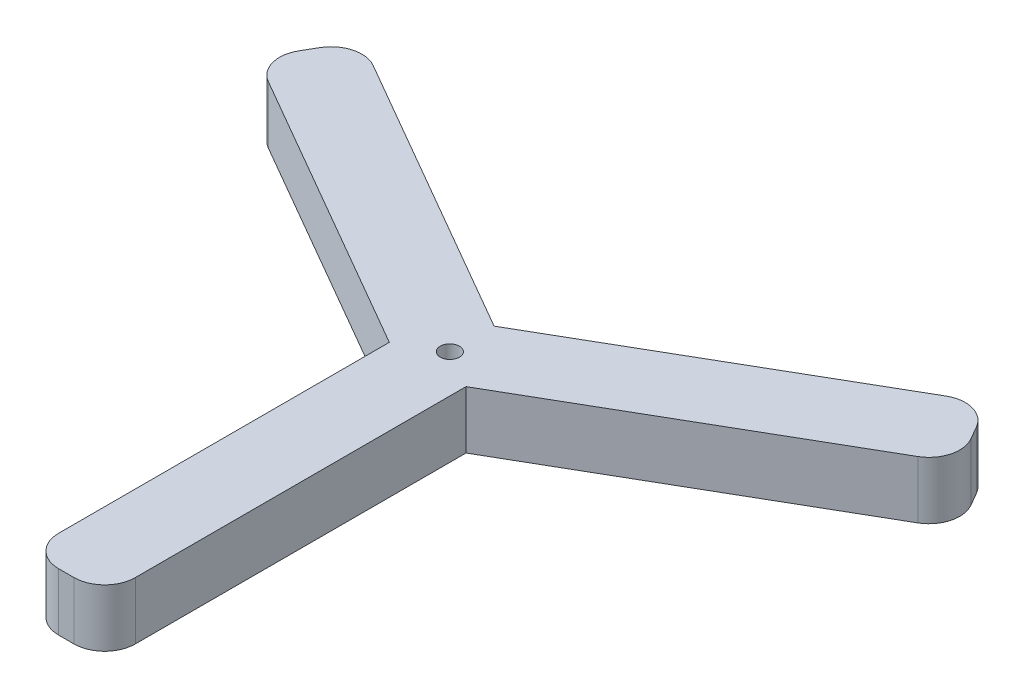
from build123d import *

# Parameters (mm, degrees)
BOSS_EXTRU_1_DEPTH      = 15
CONG_1_R                = 8
ESQUISSE2_R             = 2.5
ENL_V_MAT_EXTRU_1_DEPTH = 15


with BuildPart() as part:
    # Esquisse1 → Boss.-Extru.1 (new body)
    with BuildSketch(Plane(origin=(0, 0, 0), x_dir=(1, 0, 0), z_dir=(0, 1, 0))):
        with BuildLine():
            Line((84.674337148, 54.660254038), (10, 11.547005384))
            Line((10, 11.547005384), (-64.674337148, 54.660254038))
            ThreePointArc((-64.674337148, 54.660254038), (-70.744889509, 55.459457418), (-75.602540378, 51.732050808))
            Line((-75.602540378, 51.732050808), (-77.602540378, 48.267949192))
            ThreePointArc((-77.602540378, 48.267949192), (-78.401743758, 42.197396832), (-74.674337148, 37.339745962))
            Line((-74.674337148, 37.339745962), (0, -5.773502692))
            Line((0, -5.773502692), (0, -100))
            Line((0, -100), (20, -100))
            Line((20, -100), (20, -5.773502692))
            Line((20, -5.773502692), (94.674337148, 37.339745962))
            ThreePointArc((94.674337148, 37.339745962), (98.401743758, 42.197396832), (97.602540378, 48.267949192))
            Line((97.602540378, 48.267949192), (95.602540378, 51.732050808))
            ThreePointArc((95.602540378, 51.732050808), (90.744889509, 55.459457418), (84.674337148, 54.660254038))
        make_face()
    extrude(amount=BOSS_EXTRU_1_DEPTH)

    # Congé1
    cong_1_edges = [part.edges().sort_by_distance(p)[0] for p in [
        (0, 7.5, 100),
        (20, 7.5, 100),
    ]]
    fillet(cong_1_edges, radius=CONG_1_R)

    # Esquisse2 → Enlèv. mat.-Extru.1 (cut)
    with BuildSketch(Plane(origin=(0, 15, 0), x_dir=(1, 0, 0), z_dir=(0, 1, 0))):
        with Locations((10, 0)):
            Circle(ESQUISSE2_R)
    extrude(amount=-ENL_V_MAT_EXTRU_1_DEPTH, mode=Mode.SUBTRACT)


solid = part.part
